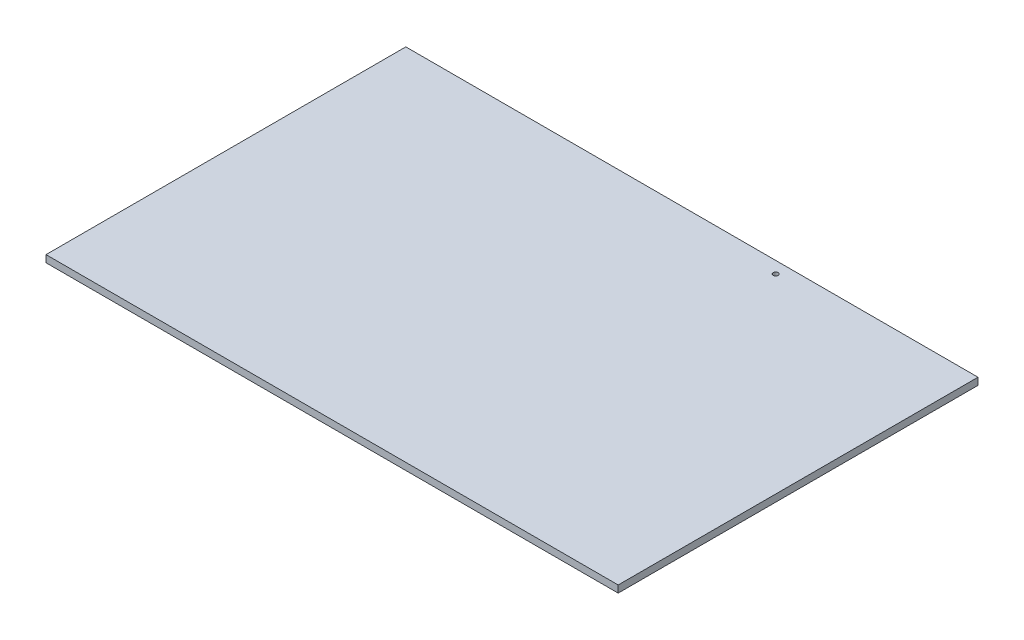
from build123d import *

# Parameters (mm, degrees)
SKETCH1_W           = 970
SKETCH1_H           = 610
BOSS_EXTRUDE1_DEPTH = 12
SKETCH2_R           = 4.233877047
CUT_EXTRUDE1_DEPTH  = 10


with BuildPart() as part:
    # Sketch1 → Boss-Extrude1 (new body)
    with BuildSketch(Plane(origin=(0, 0, 0), x_dir=(1, 0, 0), z_dir=(0, 1, 0))):
        with Locations((-192.306733167, 56.633416459)):
            Rectangle(SKETCH1_W, SKETCH1_H)
    extrude(amount=BOSS_EXTRUDE1_DEPTH)

    # Sketch2 → Cut-Extrude1 (cut)
    with BuildSketch(Plane(origin=(0, 12, 0), x_dir=(1, 0, 0), z_dir=(0, 1, 0))):
        with Locations(Location((-30.29537408, 341.621974399, 0), (0, 0, 270))):
            Circle(SKETCH2_R)
    extrude(amount=-CUT_EXTRUDE1_DEPTH, mode=Mode.SUBTRACT)


solid = part.part
